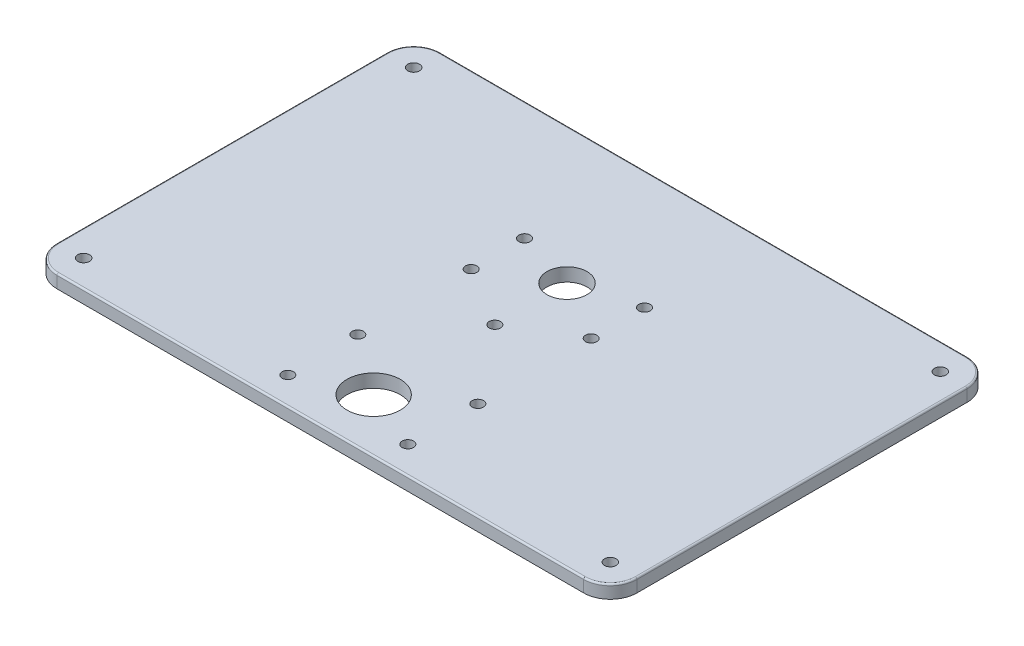
from build123d import *

# Parameters (mm, degrees)
SKETCH2_R           = 1.75
SKETCH2_R_2         = 8
SKETCH2_R_3         = 1.7
SKETCH2_R_4         = 6
BOSS_EXTRUDE1_DEPTH = 4
FILLET1_R           = 0.5


with BuildPart() as part:
    # Sketch2 → Boss-Extrude1 (new body)
    with BuildSketch(Plane(origin=(0, 0, 0), x_dir=(1, 0, 0), z_dir=(0, 1, 0))):
        with BuildLine():
            Line((87, -11), (87, 88))
            ThreePointArc((87, 88), (84.656854249, 93.656854249), (79, 96))
            Line((79, 96), (-79, 96))
            ThreePointArc((-79, 96), (-84.656854249, 93.656854249), (-87, 88))
            Line((-87, 88), (-87, -11))
            ThreePointArc((-87, -11), (-84.656854249, -16.656854249), (-79, -19))
            Line((-79, -19), (79, -19))
            ThreePointArc((79, -19), (84.656854249, -16.656854249), (87, -11))
        make_face()
        with Locations(Location((-79, 88, 0), (0, 0, 270))):
            Circle(SKETCH2_R, mode=Mode.SUBTRACT)
        with Locations(Location((79, 88, 0), (0, 0, 270))):
            Circle(SKETCH2_R, mode=Mode.SUBTRACT)
        with Locations(Location((79, -11, 0), (0, 0, 270))):
            Circle(SKETCH2_R, mode=Mode.SUBTRACT)
        with Locations(Location((-79, -11, 0), (0, 0, 270))):
            Circle(SKETCH2_R, mode=Mode.SUBTRACT)
        with Locations(Location((0, -3, 0), (0, 0, 270))):
            Circle(SKETCH2_R_2, mode=Mode.SUBTRACT)
        with Locations(Location((18, -10.75, 0), (0, 0, 270))):
            Circle(SKETCH2_R_3, mode=Mode.SUBTRACT)
        with Locations(Location((18, 10.25, 0), (0, 0, 270))):
            Circle(SKETCH2_R_3, mode=Mode.SUBTRACT)
        with Locations(Location((-18, -10.75, 0), (0, 0, 270))):
            Circle(SKETCH2_R_3, mode=Mode.SUBTRACT)
        with Locations(Location((-18, 10.25, 0), (0, 0, 270))):
            Circle(SKETCH2_R_3, mode=Mode.SUBTRACT)
        with Locations(Location((0, 33.35, 0), (0, 0, 270))):
            Circle(SKETCH2_R_3, mode=Mode.SUBTRACT)
        with Locations(Location((18, 60.25, 0), (0, 0, 270))):
            Circle(SKETCH2_R_3, mode=Mode.SUBTRACT)
        with Locations(Location((18, 44.25, 0), (0, 0, 270))):
            Circle(SKETCH2_R_3, mode=Mode.SUBTRACT)
        with Locations(Location((-18, 44.25, 0), (0, 0, 270))):
            Circle(SKETCH2_R_3, mode=Mode.SUBTRACT)
        with Locations(Location((0, 55, 0), (0, 0, 270))):
            Circle(SKETCH2_R_4, mode=Mode.SUBTRACT)
        with Locations(Location((-18, 60.25, 0), (0, 0, 270))):
            Circle(SKETCH2_R_3, mode=Mode.SUBTRACT)
    extrude(amount=BOSS_EXTRUDE1_DEPTH)

    # Fillet1
    fillet1_edges = [part.edges().sort_by_distance(p)[0] for p in [
        (84.656854249, 4, -93.656854249),
        (0, 4, -96),
        (-84.656854249, 4, -93.656854249),
        (-87, 4, -38.5),
        (-84.656854249, 4, 16.656854249),
        (0, 4, 19),
        (84.656854249, 4, 16.656854249),
        (87, 4, -38.5),
    ]]
    fillet(fillet1_edges, radius=FILLET1_R)


solid = part.part
